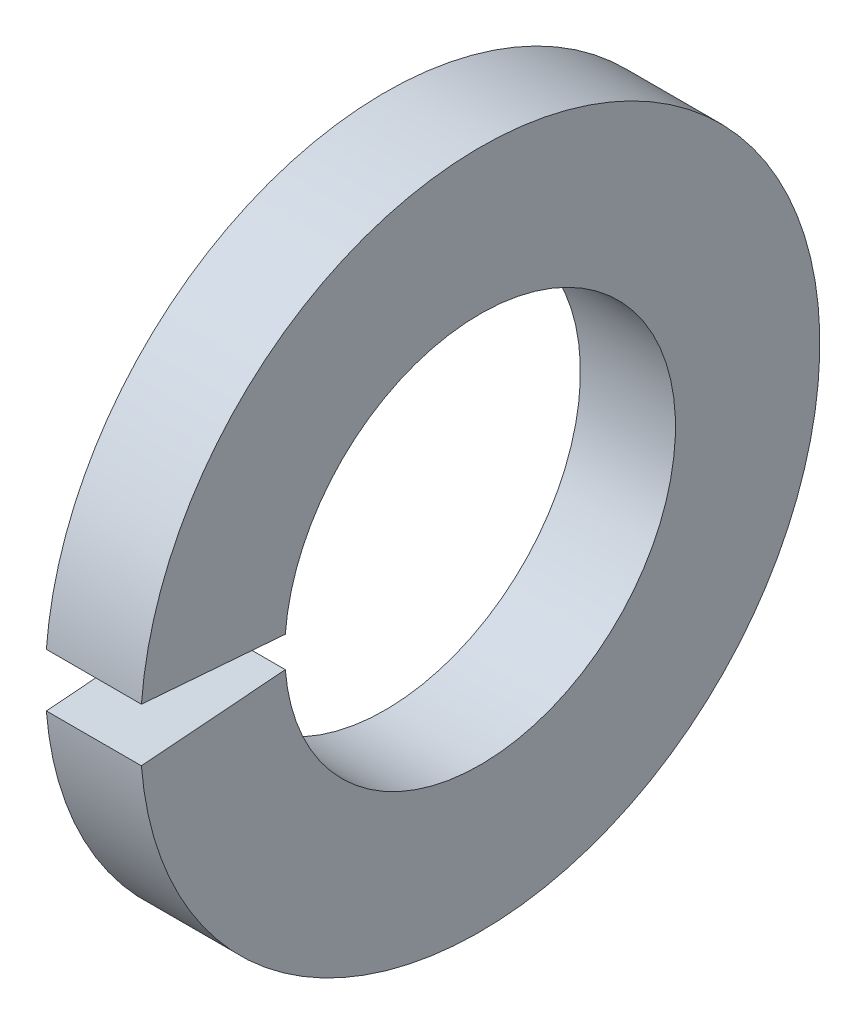
from build123d import *

# Parameters (mm, degrees)
SKETCH1_W = 2.7686
SKETCH1_H = 4.2037
GAP_DEPTH = 15.26253539


with BuildPart() as part:
    # Sketch1 → Base-Revolve (revolve)
    with BuildSketch(Plane.XY, mode=Mode.PRIVATE) as base_revolve_sk:
        with Locations((-1.3843, 7.79145)):
            Rectangle(SKETCH1_W, SKETCH1_H)
    revolve(base_revolve_sk.sketch.rotate(Axis((-34.925, 0, 0), (1, 0, 0)), 90), axis=Axis((-34.925, 0, 0), (1, 0, 0)))

    # Sketch2 → Gap (cut, through all)
    with BuildSketch(Plane(origin=(0, 0, 0), x_dir=(0, -1, 0), z_dir=(-1, 0, 0))):
        with BuildLine():
            Line((0, 0), (0.791743759, 10.060058303))
            ThreePointArc((0.791743759, 10.060058303), (0, 10.091166), (-0.791743759, 10.060058303))
            Line((-0.791743759, 10.060058303), (0, 0))
        make_face()
    extrude(amount=GAP_DEPTH, mode=Mode.SUBTRACT)


solid = part.part
